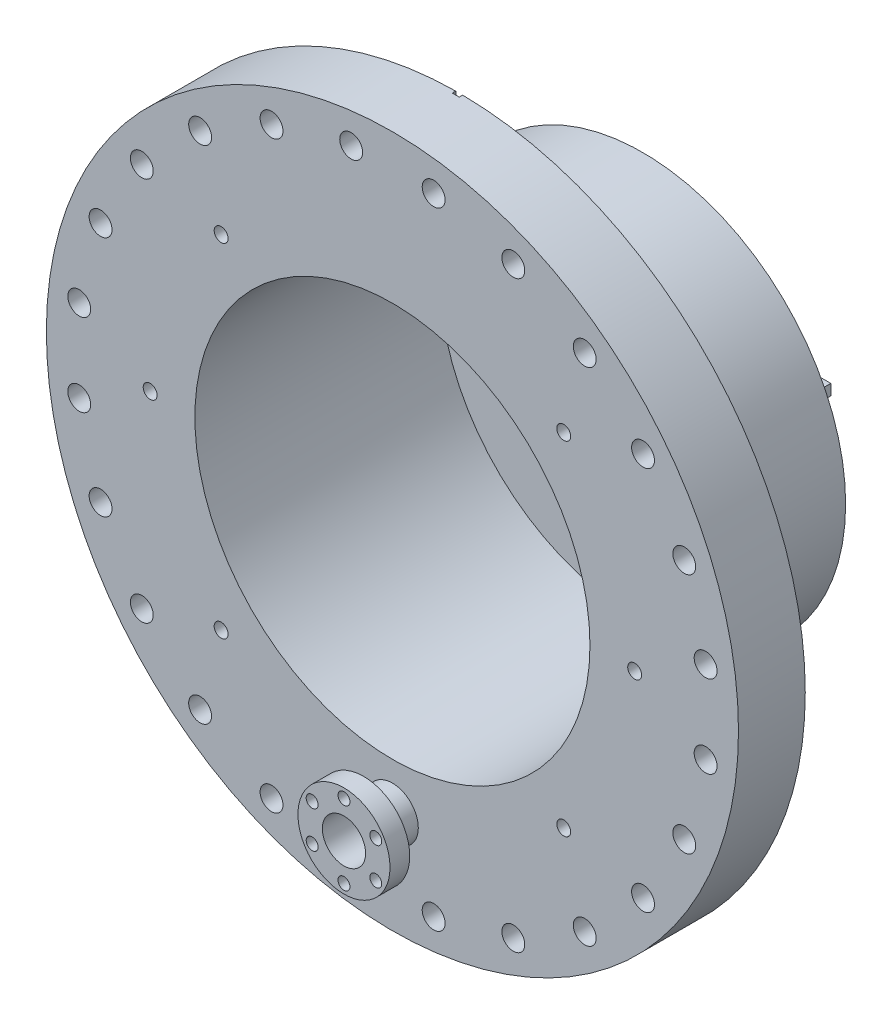
from build123d import *

# Parameters (mm, degrees)
SKETCH1_R                   = 74.5
SKETCH1_R_2                 = 72.5
EXTRUDE1_DEPTH              = 67.31
EXTRUDE2_START              = 24.511
SKETCH2_R                   = 127
SKETCH2_R_2                 = 72.5
EXTRUDE2_DEPTH              = 24.511
CUT_EXTRUDE1_REACH          = 203.715
SKETCH3_R                   = 4.2
CIRPATTERN1_COUNT           = 24
EXTRUDE3_START              = -2
SKETCH4_R                   = 74.5
SKETCH4_R_2                 = 32.2
EXTRUDE3_DEPTH              = 2
SKETCH13_R                  = 7.9375
EXTRUDE4_DEPTH              = 211.405273701
SKETCH14_R                  = 9.4996
SKETCH14_R_2                = 7.9375
EXTRUDE5_DEPTH              = 17.78
SKETCH15_R                  = 16.891
SKETCH15_R_2                = 7.9375
EXTRUDE6_DEPTH              = 7.239
SKETCH16_R                  = 2.1844
EXTRUDE7_DEPTH              = 7.239
CIRPATTERN2_COUNT           = 6
SKETCH17_W                  = 6.858832098
SKETCH17_H                  = 3.977015868
EXTRUDE8_DEPTH              = 7.62
MIRROR4_COPY_1_SKETCH_W     = 6.858832098
MIRROR4_COPY_1_SKETCH_H     = 3.977015868
MIRROR4_COPY_1_DEPTH        = 7.62
F_1_4_20_TAPPED_HOLE1_D     = 5.1054
F_1_4_20_TAPPED_HOLE1_DEPTH = 12.7
F_1_4_20_TAPPED_HOLE1_TIP   = 1.533816902
SKETCH21_W                  = 2.54
SKETCH21_H                  = 27.464757855
EXTRUDE9_DEPTH              = 1.27


with BuildPart() as part:
    # Sketch1 → Extrude1 (new body)
    with BuildSketch(Plane.XY):
        Circle(SKETCH1_R)
        Circle(SKETCH1_R_2, mode=Mode.SUBTRACT)
    extrude(amount=-EXTRUDE1_DEPTH)

    # Sketch2 → Extrude2 (add)
    with BuildSketch(Plane.XY.offset(EXTRUDE2_START)):
        Circle(SKETCH2_R)
        Circle(SKETCH2_R_2, mode=Mode.SUBTRACT)
    extrude(amount=-EXTRUDE2_DEPTH)

    # Sketch3 → Cut-Extrude1 (cut, up to next)
    with BuildSketch(Plane.XY.offset(24.511), mode=Mode.PRIVATE) as cut_extrude1_sk1:
        with Locations((15.131327149, -114.933840422)):
            Circle(SKETCH3_R)
    cut_extrude1_tool1 = extrude(cut_extrude1_sk1.sketch, amount=-CUT_EXTRUDE1_REACH, mode=Mode.PRIVATE) & part.part
    cut_extrude1 = cut_extrude1_tool1.solids().sort_by_distance((15.131327, -114.93384, 24.511))[0]
    add(cut_extrude1, mode=Mode.SUBTRACT)

    # CirPattern1: Cut-Extrude1 ×24 about axis
    cirpattern1_axis = Axis((0, 0, 0), (0, 0, 1))
    for i in range(1, CIRPATTERN1_COUNT):
        add(cut_extrude1.rotate(cirpattern1_axis, i * 360 / CIRPATTERN1_COUNT), mode=Mode.SUBTRACT)

    # Sketch4 → Extrude3 (add)
    with BuildSketch(Plane(origin=(0, 0, -67.31), x_dir=(-1, 0, 0), z_dir=(0, 0, -1)).offset(EXTRUDE3_START)):
        with Locations(Location((0, 0, 0), (0, 0, 180))):
            Circle(SKETCH4_R)
        Circle(SKETCH4_R_2, mode=Mode.SUBTRACT)
    extrude(amount=EXTRUDE3_DEPTH)

    # Sketch5 → Revolve1 (revolve)
    with BuildSketch(Plane(origin=(0, 0, 0), x_dir=(1, 0, 0), z_dir=(0, 1, 0)), mode=Mode.PRIVATE) as revolve1_sk:
        Polygon((-32.2, 67.31), (-32.2, 55.31), (-31, 55.31), (-31, 61.31), (-25, 67.31), align=None)
    revolve(revolve1_sk.sketch.rotate(Axis((0, 0, 0), (0, 0, -1)), 180), axis=Axis((0, 0, 0), (0, 0, -1)))

    # Sketch11 → Cut-Revolve1 (revolve, cut)
    with BuildSketch(Plane(origin=(0, 0, 0), x_dir=(1, 0, 0), z_dir=(0, 1, 0)), mode=Mode.PRIVATE) as cut_revolve1_sk:
        Polygon((-31.7, 67.31), (-31.7, 61.317106781), (-25.707106781, 67.31), align=None)
    revolve(cut_revolve1_sk.sketch.rotate(Axis((0, 0, 0), (0, 0, -1)), 180), axis=Axis((0, 0, 0), (0, 0, -1)), mode=Mode.SUBTRACT)

    # Sketch13 → Extrude4 (cut, through all)
    with BuildSketch(Plane.XY.offset(42.291)):
        with Locations((0, -89.535)):
            Circle(SKETCH13_R)
    extrude(amount=-EXTRUDE4_DEPTH, mode=Mode.SUBTRACT)

    # Sketch14 → Extrude5 (add)
    with BuildSketch(Plane.XY.offset(42.291)):
        with Locations((0, -89.535)):
            Circle(SKETCH14_R)
        with Locations((0, -89.535)):
            Circle(SKETCH14_R_2, mode=Mode.SUBTRACT)
    extrude(amount=-EXTRUDE5_DEPTH)

    # Sketch15 → Extrude6 (add)
    with BuildSketch(Plane.XY.offset(42.291)):
        with Locations((0, -89.535)):
            Circle(SKETCH15_R)
        with Locations((0, -89.535)):
            Circle(SKETCH15_R_2, mode=Mode.SUBTRACT)
    extrude(amount=-EXTRUDE6_DEPTH)

    # Sketch16 → Extrude7 (cut)
    with BuildSketch(Plane.XY.offset(42.291)):
        with Locations((0, -76.0476)):
            Circle(SKETCH16_R)
    extrude7 = extrude(amount=-EXTRUDE7_DEPTH, mode=Mode.SUBTRACT)

    # CirPattern2: Extrude7 ×6 about axis
    cirpattern2_axis = Axis((0, -89.535, 0), (0, 0, 1))
    for i in range(1, CIRPATTERN2_COUNT):
        add(extrude7.rotate(cirpattern2_axis, i * 360 / CIRPATTERN2_COUNT), mode=Mode.SUBTRACT)

    # Sketch17 → Extrude8 (add)
    with BuildSketch(Plane(origin=(0, 0, -67.31), x_dir=(-1, 0, 0), z_dir=(0, 0, -1))):
        with Locations((-58, -26)):
            Rectangle(SKETCH17_W, SKETCH17_H)
    extrude8 = extrude(amount=EXTRUDE8_DEPTH)

    # Mirror3: Extrude8 across plane
    add(extrude8.mirror(Plane.ZX))

    # Mirror4: Extrude8 across plane
    add(extrude8.mirror(Plane(origin=(0, 0, 0), x_dir=(0, 0, 1), z_dir=(1, 0, 0))))

    # Mirror4 copy 1 sketch → Mirror4 copy 1 (add)
    with BuildSketch(Plane(origin=(0, 0, -67.31), x_dir=(1, 0, 0), z_dir=(0, 0, -1))):
        with Locations((-58, -26)):
            Rectangle(MIRROR4_COPY_1_SKETCH_W, MIRROR4_COPY_1_SKETCH_H)
    extrude(amount=MIRROR4_COPY_1_DEPTH)

    # 1/4-20 Tapped Hole1
    with Locations(Plane(origin=(62.861792847, -62.861792847, 24.511), x_dir=(1, 0, 0), z_dir=(0, 0, 1))):
        with Locations((0, 0), (-125.723585694, 0), (-151.761792847, 62.861792847), (-125.723585694, 125.723585694), (0, 125.723585694), (26.038207153, 62.861792847)):
            Hole(F_1_4_20_TAPPED_HOLE1_D / 2, depth=F_1_4_20_TAPPED_HOLE1_DEPTH)
            with Locations((0, 0, -(F_1_4_20_TAPPED_HOLE1_DEPTH + F_1_4_20_TAPPED_HOLE1_TIP / 2))):  # 118° drill point
                Cone(0, F_1_4_20_TAPPED_HOLE1_D / 2, F_1_4_20_TAPPED_HOLE1_TIP, mode=Mode.SUBTRACT)

    # Sketch21 → Extrude9 (cut)
    with BuildSketch(Plane(origin=(0, 0, 0), x_dir=(-1, 0, 0), z_dir=(0, 0, -1))):
        with Locations((0, -119.254869633)):
            Rectangle(SKETCH21_W, SKETCH21_H)
        with Locations((0, 119.254869633)):
            Rectangle(SKETCH21_W, SKETCH21_H)
    extrude(amount=-EXTRUDE9_DEPTH, mode=Mode.SUBTRACT)


solid = part.part
